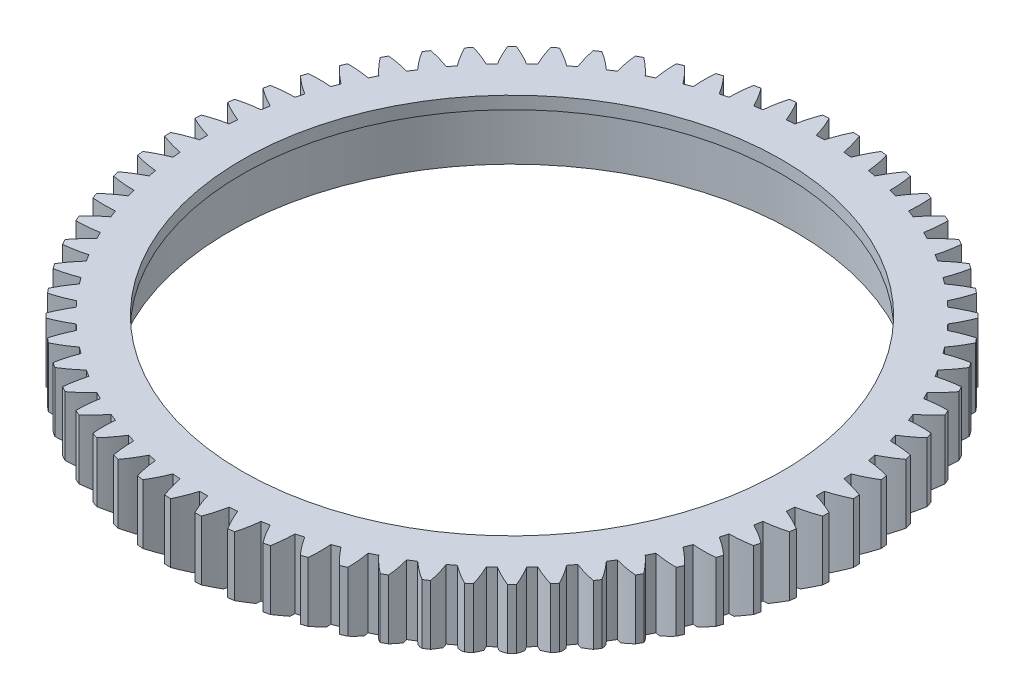
from build123d import *

# Parameters (mm, degrees)
SKETCH1_R           = 53
SKETCH1_R_2         = 43
BOSS_EXTRUDE1_DEPTH = 11
SKETCH3_R           = 45.1
CUT_EXTRUDE2_DEPTH  = 9
SKETCH4_R           = 68.194686005
CUT_EXTRUDE3_DEPTH  = 43


with BuildPart() as part:
    # Sketch1 → Boss-Extrude1 (new body)
    with BuildSketch(Plane(origin=(0, 0, 0), x_dir=(1, 0, 0), z_dir=(0, 1, 0))):
        with Locations(Location((0, 0, 0), (0, 0, 270))):
            Circle(SKETCH1_R)
        with Locations(Location((0, 0, 0), (0, 0, 270))):
            Circle(SKETCH1_R_2, mode=Mode.SUBTRACT)
    extrude(amount=BOSS_EXTRUDE1_DEPTH)

    # Sketch3 → Cut-Extrude2 (cut)
    with BuildSketch(Plane.XZ):
        with Locations(Location((0, 0, 0), (0, 0, 270))):
            Circle(SKETCH3_R)
    extrude(amount=-CUT_EXTRUDE2_DEPTH, mode=Mode.SUBTRACT)

    # Sketch4 → Cut-Extrude3 (cut)
    with BuildSketch(Plane.XZ):
        Circle(SKETCH4_R)
        with BuildLine():
            ThreePointArc((-52.464563955, 1.928608044), (-50.820807263, 1.206594741), (-49.119935663, 0.631899107))
            ThreePointArc((-49.119935663, 0.631899107), (-49.124, 0), (-49.119935663, -0.631899107))
            ThreePointArc((-49.119935663, -0.631899107), (-50.820807263, -1.206594741), (-52.464563955, -1.928608044))
            ThreePointArc((-52.464563955, -1.928608044), (-52.443981177, -2.424631579), (-52.418708875, -2.920438304))
            ThreePointArc((-52.418708875, -2.920438304), (-50.715345176, -3.487704892), (-48.968702971, -3.903012344))
            ThreePointArc((-48.968702971, -3.903012344), (-48.914445676, -4.53259089), (-48.852094383, -5.161419417))
            ThreePointArc((-48.852094383, -5.161419417), (-50.492684142, -5.890600133), (-52.062809874, -6.761200188))
            ThreePointArc((-52.062809874, -6.761200188), (-51.996547621, -7.253208635), (-51.925635853, -7.744568502))
            ThreePointArc((-51.925635853, -7.744568502), (-50.177197646, -8.152248657), (-48.399686571, -8.40462467))
            ThreePointArc((-48.399686571, -8.40462467), (-48.287570549, -9.026511313), (-48.167464259, -9.646904317))
            ThreePointArc((-48.167464259, -9.646904317), (-49.733775242, -10.524349002), (-51.216874257, -11.536108156))
            ThreePointArc((-51.216874257, -11.536108156), (-51.105497854, -12.019903872), (-50.989551614, -12.502624773))
            ThreePointArc((-50.989551614, -12.502624773), (-49.210955957, -12.747240311), (-47.41774111, -12.834531701))
            ThreePointArc((-47.41774111, -12.834531701), (-47.248722895, -13.443420724), (-47.071886313, -14.05008523))
            ThreePointArc((-47.071886313, -14.05008523), (-48.550555308, -15.068307836), (-49.933974326, -16.212594117))
            ThreePointArc((-49.933974326, -16.212594117), (-49.778433999, -16.684049528), (-49.618442499, -17.154013057))
            ThreePointArc((-49.618442499, -17.154013057), (-47.824863743, -17.233477005), (-46.031244202, -17.154939033))
            ThreePointArc((-46.031244202, -17.154939033), (-45.806765797, -17.74563561), (-45.57470763, -18.33339577))
            ThreePointArc((-45.57470763, -18.33339577), (-46.953119154, -19.483709181), (-48.225055333, -20.750759941))
            ThreePointArc((-48.225055333, -20.750759941), (-48.026678096, -21.205852756), (-47.824006328, -21.65904935))
            ThreePointArc((-47.824006328, -21.65904935), (-46.030746655, -21.572683749), (-44.252024948, -21.328986474))
            ThreePointArc((-44.252024948, -21.328986474), (-43.974001525, -21.896450989), (-43.68870161, -22.460292242))
            ThreePointArc((-43.68870161, -22.460292242), (-44.955095543, -23.732882388), (-46.104697171, -25.111887598))
            ThreePointArc((-46.104697171, -25.111887598), (-45.865175509, -25.546735125), (-45.621552597, -25.97929827))
            ThreePointArc((-45.621552597, -25.97929827), (-43.843911466, -25.727839962), (-42.09526302, -25.321062523))
            ThreePointArc((-42.09526302, -25.321062523), (-41.766066576, -25.860453569), (-41.429958993, -26.39556542))
            ThreePointArc((-41.429958993, -26.39556542), (-42.573530908, -27.779575011), (-43.590989989, -29.258769484))
            ThreePointArc((-43.590989989, -29.258769484), (-43.312367416, -29.669661757), (-43.029871865, -30.077900978))
            ThreePointArc((-43.029871865, -30.077900978), (-41.283015483, -29.663495316), (-39.57935915, -29.097108194))
            ThreePointArc((-39.57935915, -29.097108194), (-39.201798273, -29.603823877), (-38.817750574, -30.10564094))
            ThreePointArc((-38.817750574, -30.10564094), (-39.828743917, -31.589262095), (-40.705379851, -33.156025866))
            ThreePointArc((-40.705379851, -33.156025866), (-40.390033477, -33.539457297), (-40.071075439, -33.91988964))
            ThreePointArc((-40.071075439, -33.91988964), (-38.369907368, -33.346072187), (-36.725778143, -32.624907598))
            ThreePointArc((-36.725778143, -32.624907598), (-36.30307405, -33.094624798), (-35.874362793, -33.558865747))
            ThreePointArc((-35.874362793, -33.558865747), (-36.744152127, -35.129440733), (-37.472485763, -36.770406725))
            ThreePointArc((-37.472485763, -36.770406725), (-37.123106012, -37.123106012), (-36.770406725, -37.472485763))
            ThreePointArc((-36.770406725, -37.472485763), (-35.129440733, -36.744152127), (-33.558865747, -35.874362793))
            ThreePointArc((-33.558865747, -35.874362793), (-33.094624798, -36.30307405), (-32.624907598, -36.725778143))
            ThreePointArc((-32.624907598, -36.725778143), (-33.346072187, -38.369907368), (-33.91988964, -40.071075439))
            ThreePointArc((-33.91988964, -40.071075439), (-33.539457297, -40.390033477), (-33.156025866, -40.705379851))
            ThreePointArc((-33.156025866, -40.705379851), (-31.589262095, -39.828743917), (-30.10564094, -38.817750574))
            ThreePointArc((-30.10564094, -38.817750574), (-29.603823877, -39.201798273), (-29.097108194, -39.57935915))
            ThreePointArc((-29.097108194, -39.57935915), (-29.663495316, -41.283015483), (-30.077900978, -43.029871865))
            ThreePointArc((-30.077900978, -43.029871865), (-29.669661757, -43.312367416), (-29.258769484, -43.590989989))
            ThreePointArc((-29.258769484, -43.590989989), (-27.779575011, -42.573530908), (-26.39556542, -41.429958993))
            ThreePointArc((-26.39556542, -41.429958993), (-25.860453569, -41.766066576), (-25.321062523, -42.09526302))
            ThreePointArc((-25.321062523, -42.09526302), (-25.727839962, -43.843911466), (-25.97929827, -45.621552597))
            ThreePointArc((-25.97929827, -45.621552597), (-25.546735125, -45.865175509), (-25.111887598, -46.104697171))
            ThreePointArc((-25.111887598, -46.104697171), (-23.732882388, -44.955095543), (-22.460292242, -43.68870161))
            ThreePointArc((-22.460292242, -43.68870161), (-21.896450989, -43.974001525), (-21.328986474, -44.252024948))
            ThreePointArc((-21.328986474, -44.252024948), (-21.572683749, -46.030746655), (-21.65904935, -47.824006328))
            ThreePointArc((-21.65904935, -47.824006328), (-21.205852756, -48.026678096), (-20.750759941, -48.225055333))
            ThreePointArc((-20.750759941, -48.225055333), (-19.483709181, -46.953119154), (-18.33339577, -45.57470763))
            ThreePointArc((-18.33339577, -45.57470763), (-17.74563561, -45.806765797), (-17.154939033, -46.031244202))
            ThreePointArc((-17.154939033, -46.031244202), (-17.233477005, -47.824863743), (-17.154013057, -49.618442499))
            ThreePointArc((-17.154013057, -49.618442499), (-16.684049528, -49.778433999), (-16.212594117, -49.933974326))
            ThreePointArc((-16.212594117, -49.933974326), (-15.068307836, -48.550555308), (-14.05008523, -47.071886313))
            ThreePointArc((-14.05008523, -47.071886313), (-13.443420724, -47.248722895), (-12.834531701, -47.41774111))
            ThreePointArc((-12.834531701, -47.41774111), (-12.747240311, -49.210955957), (-12.502624773, -50.989551614))
            ThreePointArc((-12.502624773, -50.989551614), (-12.019903872, -51.105497854), (-11.536108156, -51.216874257))
            ThreePointArc((-11.536108156, -51.216874257), (-10.524349002, -49.733775242), (-9.646904317, -48.167464259))
            ThreePointArc((-9.646904317, -48.167464259), (-9.026511313, -48.287570549), (-8.40462467, -48.399686571))
            ThreePointArc((-8.40462467, -48.399686571), (-8.152248657, -50.177197646), (-7.744568502, -51.925635853))
            ThreePointArc((-7.744568502, -51.925635853), (-7.253208635, -51.996547621), (-6.761200188, -52.062809874))
            ThreePointArc((-6.761200188, -52.062809874), (-5.890600133, -50.492684142), (-5.161419417, -48.852094383))
            ThreePointArc((-5.161419417, -48.852094383), (-4.53259089, -48.914445676), (-3.903012344, -48.968702971))
            ThreePointArc((-3.903012344, -48.968702971), (-3.487704892, -50.715345176), (-2.920438304, -52.418708875))
            ThreePointArc((-2.920438304, -52.418708875), (-2.424631579, -52.443981177), (-1.928608044, -52.464563955))
            ThreePointArc((-1.928608044, -52.464563955), (-1.206594741, -50.820807263), (-0.631899107, -49.119935663))
            ThreePointArc((-0.631899107, -49.119935663), (0, -49.124), (0.631899107, -49.119935663))
            ThreePointArc((0.631899107, -49.119935663), (1.206594741, -50.820807263), (1.928608044, -52.464563955))
            ThreePointArc((1.928608044, -52.464563955), (2.424631579, -52.443981177), (2.920438304, -52.418708875))
            ThreePointArc((2.920438304, -52.418708875), (3.487704892, -50.715345176), (3.903012344, -48.968702971))
            ThreePointArc((3.903012344, -48.968702971), (4.53259089, -48.914445676), (5.161419417, -48.852094383))
            ThreePointArc((5.161419417, -48.852094383), (5.890600133, -50.492684142), (6.761200188, -52.062809874))
            ThreePointArc((6.761200188, -52.062809874), (7.253208635, -51.996547621), (7.744568502, -51.925635853))
            ThreePointArc((7.744568502, -51.925635853), (8.152248657, -50.177197646), (8.40462467, -48.399686571))
            ThreePointArc((8.40462467, -48.399686571), (9.026511313, -48.287570549), (9.646904317, -48.167464259))
            ThreePointArc((9.646904317, -48.167464259), (10.524349002, -49.733775242), (11.536108156, -51.216874257))
            ThreePointArc((11.536108156, -51.216874257), (12.019903872, -51.105497854), (12.502624773, -50.989551614))
            ThreePointArc((12.502624773, -50.989551614), (12.747240311, -49.210955957), (12.834531701, -47.41774111))
            ThreePointArc((12.834531701, -47.41774111), (13.443420724, -47.248722895), (14.05008523, -47.071886313))
            ThreePointArc((14.05008523, -47.071886313), (15.068307836, -48.550555308), (16.212594117, -49.933974326))
            ThreePointArc((16.212594117, -49.933974326), (16.684049528, -49.778433999), (17.154013057, -49.618442499))
            ThreePointArc((17.154013057, -49.618442499), (17.233477005, -47.824863743), (17.154939033, -46.031244202))
            ThreePointArc((17.154939033, -46.031244202), (17.74563561, -45.806765797), (18.33339577, -45.57470763))
            ThreePointArc((18.33339577, -45.57470763), (19.483709181, -46.953119154), (20.750759941, -48.225055333))
            ThreePointArc((20.750759941, -48.225055333), (21.205852756, -48.026678096), (21.65904935, -47.824006328))
            ThreePointArc((21.65904935, -47.824006328), (21.572683749, -46.030746655), (21.328986474, -44.252024948))
            ThreePointArc((21.328986474, -44.252024948), (21.896450989, -43.974001525), (22.460292242, -43.68870161))
            ThreePointArc((22.460292242, -43.68870161), (23.732882388, -44.955095543), (25.111887598, -46.104697171))
            ThreePointArc((25.111887598, -46.104697171), (25.546735125, -45.865175509), (25.97929827, -45.621552597))
            ThreePointArc((25.97929827, -45.621552597), (25.727839962, -43.843911466), (25.321062523, -42.09526302))
            ThreePointArc((25.321062523, -42.09526302), (25.860453569, -41.766066576), (26.39556542, -41.429958993))
            ThreePointArc((26.39556542, -41.429958993), (27.779575011, -42.573530908), (29.258769484, -43.590989989))
            ThreePointArc((29.258769484, -43.590989989), (29.669661757, -43.312367416), (30.077900978, -43.029871865))
            ThreePointArc((30.077900978, -43.029871865), (29.663495316, -41.283015483), (29.097108194, -39.57935915))
            ThreePointArc((29.097108194, -39.57935915), (29.603823877, -39.201798273), (30.10564094, -38.817750574))
            ThreePointArc((30.10564094, -38.817750574), (31.589262095, -39.828743917), (33.156025866, -40.705379851))
            ThreePointArc((33.156025866, -40.705379851), (33.539457297, -40.390033477), (33.91988964, -40.071075439))
            ThreePointArc((33.91988964, -40.071075439), (33.346072187, -38.369907368), (32.624907598, -36.725778143))
            ThreePointArc((32.624907598, -36.725778143), (33.094624798, -36.30307405), (33.558865747, -35.874362793))
            ThreePointArc((33.558865747, -35.874362793), (35.129440733, -36.744152127), (36.770406725, -37.472485763))
            ThreePointArc((36.770406725, -37.472485763), (37.123106012, -37.123106012), (37.472485763, -36.770406725))
            ThreePointArc((37.472485763, -36.770406725), (36.744152127, -35.129440733), (35.874362793, -33.558865747))
            ThreePointArc((35.874362793, -33.558865747), (36.30307405, -33.094624798), (36.725778143, -32.624907598))
            ThreePointArc((36.725778143, -32.624907598), (38.369907368, -33.346072187), (40.071075439, -33.91988964))
            ThreePointArc((40.071075439, -33.91988964), (40.390033477, -33.539457297), (40.705379851, -33.156025866))
            ThreePointArc((40.705379851, -33.156025866), (39.828743917, -31.589262095), (38.817750574, -30.10564094))
            ThreePointArc((38.817750574, -30.10564094), (39.201798273, -29.603823877), (39.57935915, -29.097108194))
            ThreePointArc((39.57935915, -29.097108194), (41.283015483, -29.663495316), (43.029871865, -30.077900978))
            ThreePointArc((43.029871865, -30.077900978), (43.312367416, -29.669661757), (43.590989989, -29.258769484))
            ThreePointArc((43.590989989, -29.258769484), (42.573530908, -27.779575011), (41.429958993, -26.39556542))
            ThreePointArc((41.429958993, -26.39556542), (41.766066576, -25.860453569), (42.09526302, -25.321062523))
            ThreePointArc((42.09526302, -25.321062523), (43.843911466, -25.727839962), (45.621552597, -25.97929827))
            ThreePointArc((45.621552597, -25.97929827), (45.865175509, -25.546735125), (46.104697171, -25.111887598))
            ThreePointArc((46.104697171, -25.111887598), (44.955095543, -23.732882388), (43.68870161, -22.460292242))
            ThreePointArc((43.68870161, -22.460292242), (43.974001525, -21.896450989), (44.252024948, -21.328986474))
            ThreePointArc((44.252024948, -21.328986474), (46.030746655, -21.572683749), (47.824006328, -21.65904935))
            ThreePointArc((47.824006328, -21.65904935), (48.026678096, -21.205852756), (48.225055333, -20.750759941))
            ThreePointArc((48.225055333, -20.750759941), (46.953119154, -19.483709181), (45.57470763, -18.33339577))
            ThreePointArc((45.57470763, -18.33339577), (45.806765797, -17.74563561), (46.031244202, -17.154939033))
            ThreePointArc((46.031244202, -17.154939033), (47.824863743, -17.233477005), (49.618442499, -17.154013057))
            ThreePointArc((49.618442499, -17.154013057), (49.778433999, -16.684049528), (49.933974326, -16.212594117))
            ThreePointArc((49.933974326, -16.212594117), (48.550555308, -15.068307836), (47.071886313, -14.05008523))
            ThreePointArc((47.071886313, -14.05008523), (47.248722895, -13.443420724), (47.41774111, -12.834531701))
            ThreePointArc((47.41774111, -12.834531701), (49.210955957, -12.747240311), (50.989551614, -12.502624773))
            ThreePointArc((50.989551614, -12.502624773), (51.105497854, -12.019903872), (51.216874257, -11.536108156))
            ThreePointArc((51.216874257, -11.536108156), (49.733775242, -10.524349002), (48.167464259, -9.646904317))
            ThreePointArc((48.167464259, -9.646904317), (48.287570549, -9.026511313), (48.399686571, -8.40462467))
            ThreePointArc((48.399686571, -8.40462467), (50.177197646, -8.152248657), (51.925635853, -7.744568502))
            ThreePointArc((51.925635853, -7.744568502), (51.996547621, -7.253208635), (52.062809874, -6.761200188))
            ThreePointArc((52.062809874, -6.761200188), (50.492684142, -5.890600133), (48.852094383, -5.161419417))
            ThreePointArc((48.852094383, -5.161419417), (48.914445676, -4.53259089), (48.968702971, -3.903012344))
            ThreePointArc((48.968702971, -3.903012344), (50.715345176, -3.487704892), (52.418708875, -2.920438304))
            ThreePointArc((52.418708875, -2.920438304), (52.443981177, -2.424631579), (52.464563955, -1.928608044))
            ThreePointArc((52.464563955, -1.928608044), (50.820807263, -1.206594741), (49.119935663, -0.631899107))
            ThreePointArc((49.119935663, -0.631899107), (49.124, 0), (49.119935663, 0.631899107))
            ThreePointArc((49.119935663, 0.631899107), (50.820807263, 1.206594741), (52.464563955, 1.928608044))
            ThreePointArc((52.464563955, 1.928608044), (52.443981177, 2.424631579), (52.418708875, 2.920438304))
            ThreePointArc((52.418708875, 2.920438304), (50.715345176, 3.487704892), (48.968702971, 3.903012344))
            ThreePointArc((48.968702971, 3.903012344), (48.914445676, 4.53259089), (48.852094383, 5.161419417))
            ThreePointArc((48.852094383, 5.161419417), (50.492684142, 5.890600133), (52.062809874, 6.761200188))
            ThreePointArc((52.062809874, 6.761200188), (51.996547621, 7.253208635), (51.925635853, 7.744568502))
            ThreePointArc((51.925635853, 7.744568502), (50.177197646, 8.152248657), (48.399686571, 8.40462467))
            ThreePointArc((48.399686571, 8.40462467), (48.287570549, 9.026511313), (48.167464259, 9.646904317))
            ThreePointArc((48.167464259, 9.646904317), (49.733775242, 10.524349002), (51.216874257, 11.536108156))
            ThreePointArc((51.216874257, 11.536108156), (51.105497854, 12.019903872), (50.989551614, 12.502624773))
            ThreePointArc((50.989551614, 12.502624773), (49.210955957, 12.747240311), (47.41774111, 12.834531701))
            ThreePointArc((47.41774111, 12.834531701), (47.248722895, 13.443420724), (47.071886313, 14.05008523))
            ThreePointArc((47.071886313, 14.05008523), (48.550555308, 15.068307836), (49.933974326, 16.212594117))
            ThreePointArc((49.933974326, 16.212594117), (49.778433999, 16.684049528), (49.618442499, 17.154013057))
            ThreePointArc((49.618442499, 17.154013057), (47.824863743, 17.233477005), (46.031244202, 17.154939033))
            ThreePointArc((46.031244202, 17.154939033), (45.806765797, 17.74563561), (45.57470763, 18.33339577))
            ThreePointArc((45.57470763, 18.33339577), (46.953119154, 19.483709181), (48.225055333, 20.750759941))
            ThreePointArc((48.225055333, 20.750759941), (48.026678096, 21.205852756), (47.824006328, 21.65904935))
            ThreePointArc((47.824006328, 21.65904935), (46.030746655, 21.572683749), (44.252024948, 21.328986474))
            ThreePointArc((44.252024948, 21.328986474), (43.974001525, 21.896450989), (43.68870161, 22.460292242))
            ThreePointArc((43.68870161, 22.460292242), (44.955095543, 23.732882388), (46.104697171, 25.111887598))
            ThreePointArc((46.104697171, 25.111887598), (45.865175509, 25.546735125), (45.621552597, 25.97929827))
            ThreePointArc((45.621552597, 25.97929827), (43.843911466, 25.727839962), (42.09526302, 25.321062523))
            ThreePointArc((42.09526302, 25.321062523), (41.766066576, 25.860453569), (41.429958993, 26.39556542))
            ThreePointArc((41.429958993, 26.39556542), (42.573530908, 27.779575011), (43.590989989, 29.258769484))
            ThreePointArc((43.590989989, 29.258769484), (43.312367416, 29.669661757), (43.029871865, 30.077900978))
            ThreePointArc((43.029871865, 30.077900978), (41.283015483, 29.663495316), (39.57935915, 29.097108194))
            ThreePointArc((39.57935915, 29.097108194), (39.201798273, 29.603823877), (38.817750574, 30.10564094))
            ThreePointArc((38.817750574, 30.10564094), (39.828743917, 31.589262095), (40.705379851, 33.156025866))
            ThreePointArc((40.705379851, 33.156025866), (40.390033477, 33.539457297), (40.071075439, 33.91988964))
            ThreePointArc((40.071075439, 33.91988964), (38.369907368, 33.346072187), (36.725778143, 32.624907598))
            ThreePointArc((36.725778143, 32.624907598), (36.30307405, 33.094624798), (35.874362793, 33.558865747))
            ThreePointArc((35.874362793, 33.558865747), (36.744152127, 35.129440733), (37.472485763, 36.770406725))
            ThreePointArc((37.472485763, 36.770406725), (37.123106012, 37.123106012), (36.770406725, 37.472485763))
            ThreePointArc((36.770406725, 37.472485763), (35.129440733, 36.744152127), (33.558865747, 35.874362793))
            ThreePointArc((33.558865747, 35.874362793), (33.094624798, 36.30307405), (32.624907598, 36.725778143))
            ThreePointArc((32.624907598, 36.725778143), (33.346072187, 38.369907368), (33.91988964, 40.071075439))
            ThreePointArc((33.91988964, 40.071075439), (33.539457297, 40.390033477), (33.156025866, 40.705379851))
            ThreePointArc((33.156025866, 40.705379851), (31.589262095, 39.828743917), (30.10564094, 38.817750574))
            ThreePointArc((30.10564094, 38.817750574), (29.603823877, 39.201798273), (29.097108194, 39.57935915))
            ThreePointArc((29.097108194, 39.57935915), (29.663495316, 41.283015483), (30.077900978, 43.029871865))
            ThreePointArc((30.077900978, 43.029871865), (29.669661757, 43.312367416), (29.258769484, 43.590989989))
            ThreePointArc((29.258769484, 43.590989989), (27.779575011, 42.573530908), (26.39556542, 41.429958993))
            ThreePointArc((26.39556542, 41.429958993), (25.860453569, 41.766066576), (25.321062523, 42.09526302))
            ThreePointArc((25.321062523, 42.09526302), (25.727839962, 43.843911466), (25.97929827, 45.621552597))
            ThreePointArc((25.97929827, 45.621552597), (25.546735125, 45.865175509), (25.111887598, 46.104697171))
            ThreePointArc((25.111887598, 46.104697171), (23.732882388, 44.955095543), (22.460292242, 43.68870161))
            ThreePointArc((22.460292242, 43.68870161), (21.896450989, 43.974001525), (21.328986474, 44.252024948))
            ThreePointArc((21.328986474, 44.252024948), (21.572683749, 46.030746655), (21.65904935, 47.824006328))
            ThreePointArc((21.65904935, 47.824006328), (21.205852756, 48.026678096), (20.750759941, 48.225055333))
            ThreePointArc((20.750759941, 48.225055333), (19.483709181, 46.953119154), (18.33339577, 45.57470763))
            ThreePointArc((18.33339577, 45.57470763), (17.74563561, 45.806765797), (17.154939033, 46.031244202))
            ThreePointArc((17.154939033, 46.031244202), (17.233477005, 47.824863743), (17.154013057, 49.618442499))
            ThreePointArc((17.154013057, 49.618442499), (16.684049528, 49.778433999), (16.212594117, 49.933974326))
            ThreePointArc((16.212594117, 49.933974326), (15.068307836, 48.550555308), (14.05008523, 47.071886313))
            ThreePointArc((14.05008523, 47.071886313), (13.443420724, 47.248722895), (12.834531701, 47.41774111))
            ThreePointArc((12.834531701, 47.41774111), (12.747240311, 49.210955957), (12.502624773, 50.989551614))
            ThreePointArc((12.502624773, 50.989551614), (12.019903872, 51.105497854), (11.536108156, 51.216874257))
            ThreePointArc((11.536108156, 51.216874257), (10.524349002, 49.733775242), (9.646904317, 48.167464259))
            ThreePointArc((9.646904317, 48.167464259), (9.026511313, 48.287570549), (8.40462467, 48.399686571))
            ThreePointArc((8.40462467, 48.399686571), (8.152248657, 50.177197646), (7.744568502, 51.925635853))
            ThreePointArc((7.744568502, 51.925635853), (7.253208635, 51.996547621), (6.761200188, 52.062809874))
            ThreePointArc((6.761200188, 52.062809874), (5.890600133, 50.492684142), (5.161419417, 48.852094383))
            ThreePointArc((5.161419417, 48.852094383), (4.53259089, 48.914445676), (3.903012344, 48.968702971))
            ThreePointArc((3.903012344, 48.968702971), (3.487704892, 50.715345176), (2.920438304, 52.418708875))
            ThreePointArc((2.920438304, 52.418708875), (2.424631579, 52.443981177), (1.928608044, 52.464563955))
            ThreePointArc((1.928608044, 52.464563955), (1.206594741, 50.820807263), (0.631899107, 49.119935663))
            ThreePointArc((0.631899107, 49.119935663), (0, 49.124), (-0.631899107, 49.119935663))
            ThreePointArc((-0.631899107, 49.119935663), (-1.206594741, 50.820807263), (-1.928608044, 52.464563955))
            ThreePointArc((-1.928608044, 52.464563955), (-2.424631579, 52.443981177), (-2.920438304, 52.418708875))
            ThreePointArc((-2.920438304, 52.418708875), (-3.487704892, 50.715345176), (-3.903012344, 48.968702971))
            ThreePointArc((-3.903012344, 48.968702971), (-4.53259089, 48.914445676), (-5.161419417, 48.852094383))
            ThreePointArc((-5.161419417, 48.852094383), (-5.890600133, 50.492684142), (-6.761200188, 52.062809874))
            ThreePointArc((-6.761200188, 52.062809874), (-7.253208635, 51.996547621), (-7.744568502, 51.925635853))
            ThreePointArc((-7.744568502, 51.925635853), (-8.152248657, 50.177197646), (-8.40462467, 48.399686571))
            ThreePointArc((-8.40462467, 48.399686571), (-9.026511313, 48.287570549), (-9.646904317, 48.167464259))
            ThreePointArc((-9.646904317, 48.167464259), (-10.524349002, 49.733775242), (-11.536108156, 51.216874257))
            ThreePointArc((-11.536108156, 51.216874257), (-12.019903872, 51.105497854), (-12.502624773, 50.989551614))
            ThreePointArc((-12.502624773, 50.989551614), (-12.747240311, 49.210955957), (-12.834531701, 47.41774111))
            ThreePointArc((-12.834531701, 47.41774111), (-13.443420724, 47.248722895), (-14.05008523, 47.071886313))
            ThreePointArc((-14.05008523, 47.071886313), (-15.068307836, 48.550555308), (-16.212594117, 49.933974326))
            ThreePointArc((-16.212594117, 49.933974326), (-16.684049528, 49.778433999), (-17.154013057, 49.618442499))
            ThreePointArc((-17.154013057, 49.618442499), (-17.233477005, 47.824863743), (-17.154939033, 46.031244202))
            ThreePointArc((-17.154939033, 46.031244202), (-17.74563561, 45.806765797), (-18.33339577, 45.57470763))
            ThreePointArc((-18.33339577, 45.57470763), (-19.483709181, 46.953119154), (-20.750759941, 48.225055333))
            ThreePointArc((-20.750759941, 48.225055333), (-21.205852756, 48.026678096), (-21.65904935, 47.824006328))
            ThreePointArc((-21.65904935, 47.824006328), (-21.572683749, 46.030746655), (-21.328986474, 44.252024948))
            ThreePointArc((-21.328986474, 44.252024948), (-21.896450989, 43.974001525), (-22.460292242, 43.68870161))
            ThreePointArc((-22.460292242, 43.68870161), (-23.732882388, 44.955095543), (-25.111887598, 46.104697171))
            ThreePointArc((-25.111887598, 46.104697171), (-25.546735125, 45.865175509), (-25.97929827, 45.621552597))
            ThreePointArc((-25.97929827, 45.621552597), (-25.727839962, 43.843911466), (-25.321062523, 42.09526302))
            ThreePointArc((-25.321062523, 42.09526302), (-25.860453569, 41.766066576), (-26.39556542, 41.429958993))
            ThreePointArc((-26.39556542, 41.429958993), (-27.779575011, 42.573530908), (-29.258769484, 43.590989989))
            ThreePointArc((-29.258769484, 43.590989989), (-29.669661757, 43.312367416), (-30.077900978, 43.029871865))
            ThreePointArc((-30.077900978, 43.029871865), (-29.663495316, 41.283015483), (-29.097108194, 39.57935915))
            ThreePointArc((-29.097108194, 39.57935915), (-29.603823877, 39.201798273), (-30.10564094, 38.817750574))
            ThreePointArc((-30.10564094, 38.817750574), (-31.589262095, 39.828743917), (-33.156025866, 40.705379851))
            ThreePointArc((-33.156025866, 40.705379851), (-33.539457297, 40.390033477), (-33.91988964, 40.071075439))
            ThreePointArc((-33.91988964, 40.071075439), (-33.346072187, 38.369907368), (-32.624907598, 36.725778143))
            ThreePointArc((-32.624907598, 36.725778143), (-33.094624798, 36.30307405), (-33.558865747, 35.874362793))
            ThreePointArc((-33.558865747, 35.874362793), (-35.129440733, 36.744152127), (-36.770406725, 37.472485763))
            ThreePointArc((-36.770406725, 37.472485763), (-37.123106012, 37.123106012), (-37.472485763, 36.770406725))
            ThreePointArc((-37.472485763, 36.770406725), (-36.744152127, 35.129440733), (-35.874362793, 33.558865747))
            ThreePointArc((-35.874362793, 33.558865747), (-36.30307405, 33.094624798), (-36.725778143, 32.624907598))
            ThreePointArc((-36.725778143, 32.624907598), (-38.369907368, 33.346072187), (-40.071075439, 33.91988964))
            ThreePointArc((-40.071075439, 33.91988964), (-40.390033477, 33.539457297), (-40.705379851, 33.156025866))
            ThreePointArc((-40.705379851, 33.156025866), (-39.828743917, 31.589262095), (-38.817750574, 30.10564094))
            ThreePointArc((-38.817750574, 30.10564094), (-39.201798273, 29.603823877), (-39.57935915, 29.097108194))
            ThreePointArc((-39.57935915, 29.097108194), (-41.283015483, 29.663495316), (-43.029871865, 30.077900978))
            ThreePointArc((-43.029871865, 30.077900978), (-43.312367416, 29.669661757), (-43.590989989, 29.258769484))
            ThreePointArc((-43.590989989, 29.258769484), (-42.573530908, 27.779575011), (-41.429958993, 26.39556542))
            ThreePointArc((-41.429958993, 26.39556542), (-41.766066576, 25.860453569), (-42.09526302, 25.321062523))
            ThreePointArc((-42.09526302, 25.321062523), (-43.843911466, 25.727839962), (-45.621552597, 25.97929827))
            ThreePointArc((-45.621552597, 25.97929827), (-45.865175509, 25.546735125), (-46.104697171, 25.111887598))
            ThreePointArc((-46.104697171, 25.111887598), (-44.955095543, 23.732882388), (-43.68870161, 22.460292242))
            ThreePointArc((-43.68870161, 22.460292242), (-43.974001525, 21.896450989), (-44.252024948, 21.328986474))
            ThreePointArc((-44.252024948, 21.328986474), (-46.030746655, 21.572683749), (-47.824006328, 21.65904935))
            ThreePointArc((-47.824006328, 21.65904935), (-48.026678096, 21.205852756), (-48.225055333, 20.750759941))
            ThreePointArc((-48.225055333, 20.750759941), (-46.953119154, 19.483709181), (-45.57470763, 18.33339577))
            ThreePointArc((-45.57470763, 18.33339577), (-45.806765797, 17.74563561), (-46.031244202, 17.154939033))
            ThreePointArc((-46.031244202, 17.154939033), (-47.824863743, 17.233477005), (-49.618442499, 17.154013057))
            ThreePointArc((-49.618442499, 17.154013057), (-49.778433999, 16.684049528), (-49.933974326, 16.212594117))
            ThreePointArc((-49.933974326, 16.212594117), (-48.550555308, 15.068307836), (-47.071886313, 14.05008523))
            ThreePointArc((-47.071886313, 14.05008523), (-47.248722895, 13.443420724), (-47.41774111, 12.834531701))
            ThreePointArc((-47.41774111, 12.834531701), (-49.210955957, 12.747240311), (-50.989551614, 12.502624773))
            ThreePointArc((-50.989551614, 12.502624773), (-51.105497854, 12.019903872), (-51.216874257, 11.536108156))
            ThreePointArc((-51.216874257, 11.536108156), (-49.733775242, 10.524349002), (-48.167464259, 9.646904317))
            ThreePointArc((-48.167464259, 9.646904317), (-48.287570549, 9.026511313), (-48.399686571, 8.40462467))
            ThreePointArc((-48.399686571, 8.40462467), (-50.177197646, 8.152248657), (-51.925635853, 7.744568502))
            ThreePointArc((-51.925635853, 7.744568502), (-51.996547621, 7.253208635), (-52.062809874, 6.761200188))
            ThreePointArc((-52.062809874, 6.761200188), (-50.492684142, 5.890600133), (-48.852094383, 5.161419417))
            ThreePointArc((-48.852094383, 5.161419417), (-48.914445676, 4.53259089), (-48.968702971, 3.903012344))
            ThreePointArc((-48.968702971, 3.903012344), (-50.715345176, 3.487704892), (-52.418708875, 2.920438304))
            ThreePointArc((-52.418708875, 2.920438304), (-52.443981177, 2.424631579), (-52.464563955, 1.928608044))
        make_face(mode=Mode.SUBTRACT)
    extrude(amount=-CUT_EXTRUDE3_DEPTH, mode=Mode.SUBTRACT)

    # Sketch5 → Cut-Revolve1 (revolve, cut)
    with BuildSketch(Plane(origin=(0, 0, 0), x_dir=(0, 0, -1), z_dir=(1, 0, 0)), mode=Mode.PRIVATE) as cut_revolve1_sk:
        Polygon((-54.227217134, 2.466856542), (-47.225064023, -1.488558193), (-54.227217134, -2.630525352), align=None)
    revolve(cut_revolve1_sk.sketch.rotate(Axis((0, 0, 0), (0, 1, 0)), 180), axis=Axis((0, 0, 0), (0, 1, 0)), mode=Mode.SUBTRACT)


solid = part.part
